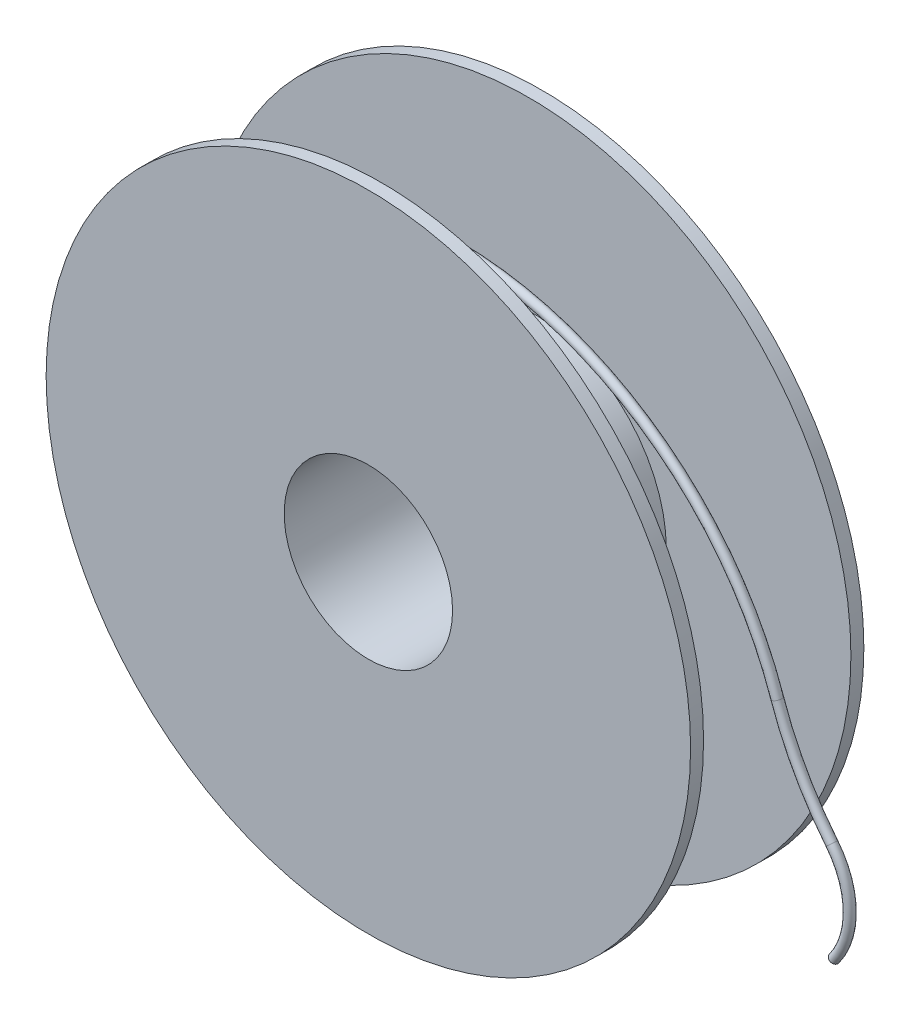
from build123d import *

# Parameters (mm, degrees)
ESQUISSE3_R = 1.425


with BuildPart() as part:
    # Esquisse1 → Révolution1 (revolve)
    with BuildSketch(Plane(origin=(0, 0, 0), x_dir=(1, 0, 0), z_dir=(0, 1, 0))):
        Polygon((26, -26.75), (99.5, -26.75), (99.5, -22.75), (42.5, -22.75), (42.5, 22.75), (99.5, 22.75), (99.5, 26.75), (26, 26.75), align=None)
    revolve(axis=Axis((0, 0, 0), (0, 0, -1)))


with BuildPart() as body_2:
    # Balayage1: sweep along a path in Esquisse2
    with BuildLine(Plane.XY) as balayage1_path:
        ThreePointArc((-42.5, 0), (-52.576271632, 4.173728368), (-56.75, 14.25))
        ThreePointArc((-56.75, 14.25), (-40.128309832, 54.378309832), (0, 71))
        ThreePointArc((0, 71), (61.117202979, 51.430094316), (99.5, 0))
        ThreePointArc((99.5, 0), (106.584087108, -15.926727523), (116.326198226, -30.381353452))
        ThreePointArc((116.326198226, -30.381353452), (121.883490614, -45.461964379), (117.111892834, -60.809282688))
    # Esquisse3 → Balayage1 (sweep)
    with BuildSketch(Plane.ZY.offset(42.5)):
        Circle(ESQUISSE3_R)
    sweep(path=balayage1_path.line)


solid = Compound([part.part, body_2.part])
